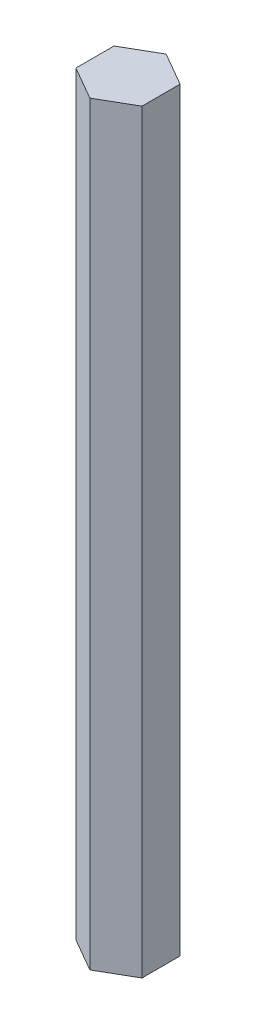
from build123d import *

# Parameters (mm, degrees)
BOSS_EXTRUDE1_DEPTH = 101.6


with BuildPart() as part:
    # Sketch1 → Boss-Extrude1 (new body)
    with BuildSketch(Plane(origin=(0, 0, 0), x_dir=(1, 0, 0), z_dir=(0, 1, 0))):
        Polygon((-1.323022376, 7.424185867), (-5.768022376, 4.857863921), (-5.768022376, -0.274779972), (-1.323022376, -2.841101919), (3.121977624, -0.274779972), (3.121977624, 4.857863921), align=None)
    extrude(amount=BOSS_EXTRUDE1_DEPTH)


solid = part.part
